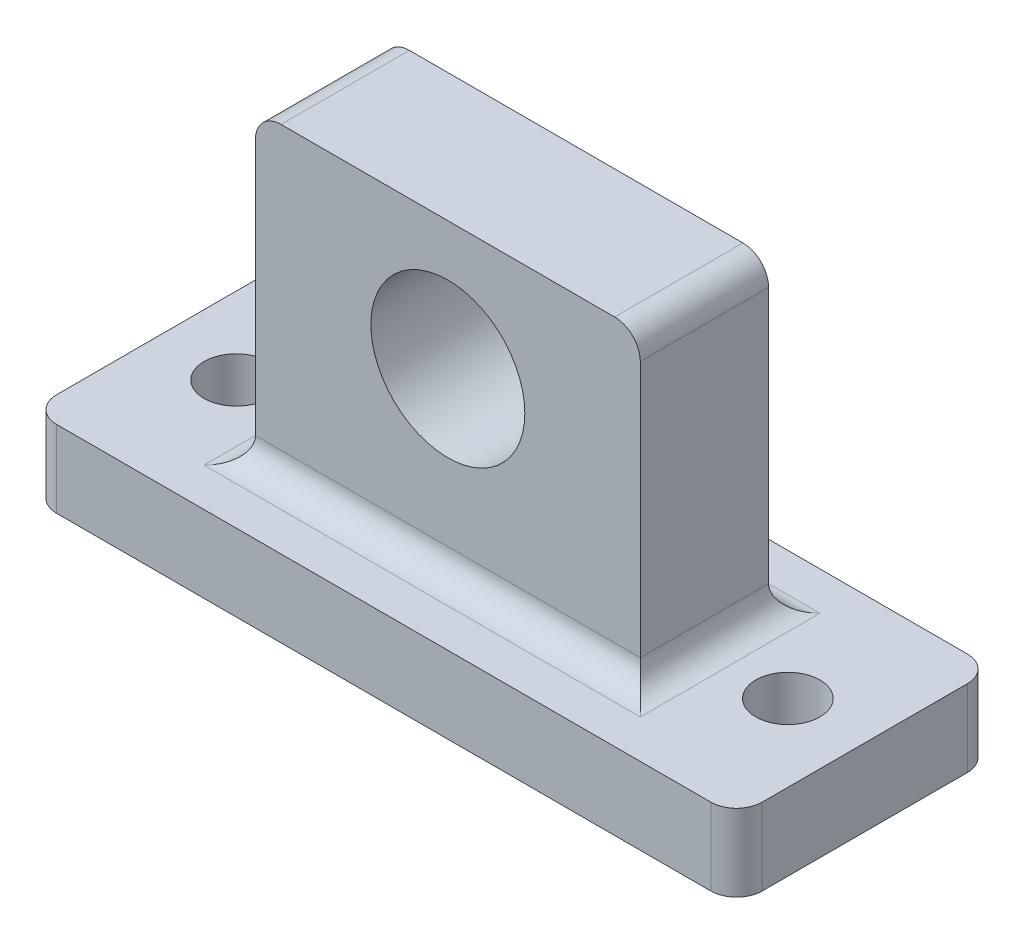
from build123d import *

# Parameters (mm, degrees)
SKETCH1_W           = 30
SKETCH1_H           = 30
SKETCH1_R           = 6
BOSS_EXTRUDE1_DEPTH = 10
SKETCH2_W           = 55
SKETCH2_H           = 20
SKETCH2_R           = 2.5
BOSS_EXTRUDE2_DEPTH = 6
FILLET1_R           = 2


with BuildPart() as part:
    # Sketch1 → Boss-Extrude1 (new body)
    with BuildSketch(Plane.XY):
        with Locations((15, 15)):
            Rectangle(SKETCH1_W, SKETCH1_H)
        with Locations((15, 20)):
            Circle(SKETCH1_R, mode=Mode.SUBTRACT)
    extrude(amount=BOSS_EXTRUDE1_DEPTH)

    # Sketch2 → Boss-Extrude2 (add)
    with BuildSketch(Plane(origin=(0, 0, 0), x_dir=(-1, 0, 0), z_dir=(0, -1, 0))):
        with Locations((-15, -5)):
            Rectangle(SKETCH2_W, SKETCH2_H)
        with Locations(Location((6.5, -5, 0), (0, 0, 90))):
            Circle(SKETCH2_R, mode=Mode.SUBTRACT)
        with Locations(Location((-36.5, -5, 0), (0, 0, 270))):
            Circle(SKETCH2_R, mode=Mode.SUBTRACT)
    extrude(amount=-BOSS_EXTRUDE2_DEPTH)

    # Fillet1
    fillet1_edges = [part.edges().sort_by_distance(p)[0] for p in [
        (30, 6, 5),
        (15, 6, 10),
        (0, 6, 5),
        (42.5, 3, 15),
        (42.5, 3, -5),
        (-12.5, 3, -5),
        (-12.5, 3, 15),
        (15, 6, 0),
        (0, 30, 5),
        (30, 30, 5),
    ]]
    fillet(fillet1_edges, radius=FILLET1_R)


solid = part.part
